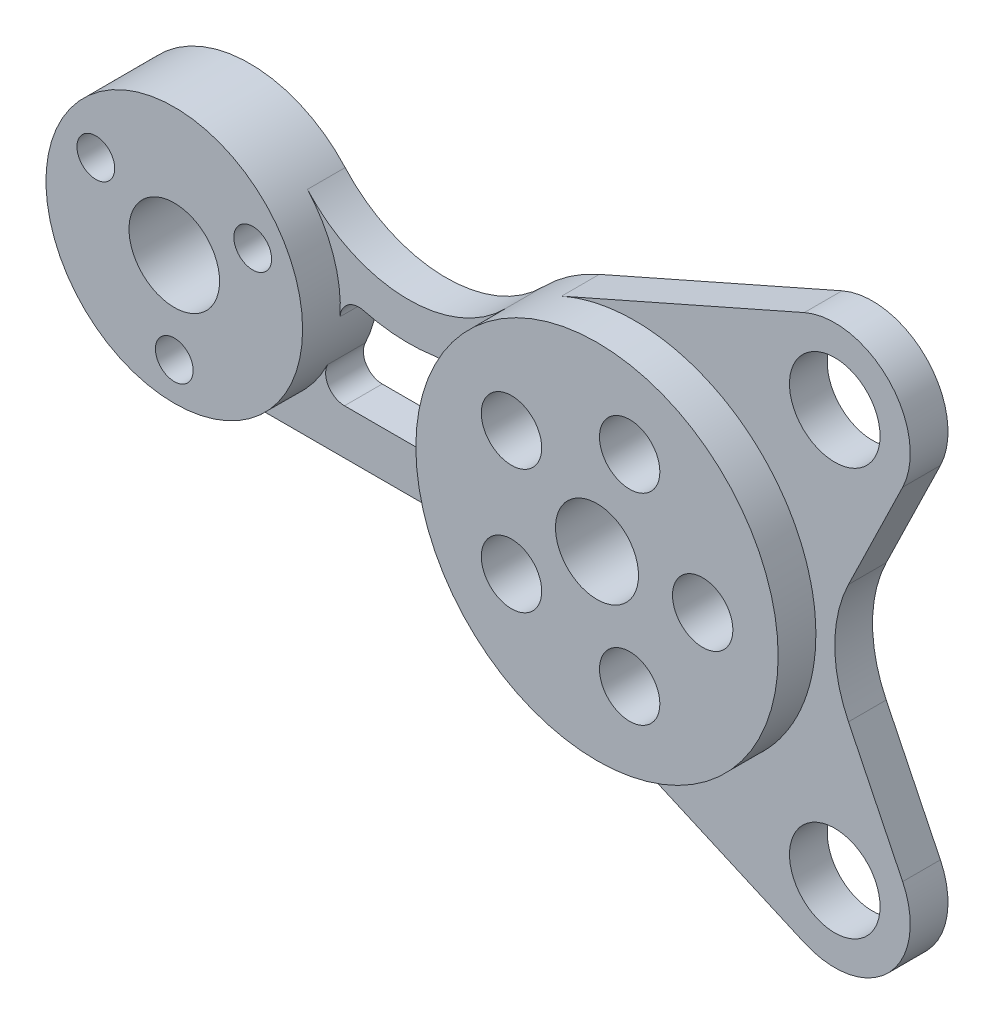
from build123d import *

# Parameters (mm, degrees)
EXTRUDE_1_DEPTH   = 10
EXTRUDE_1_2_DEPTH = 10
SKETCH_1_R        = 12
EXTRUDE_1_3_DEPTH = 10
SKETCH_1_3_R      = 34
SKETCH_1_3_R_2    = 5
SKETCH_1_3_R_3    = 12
SKETCH_1_3_R_4    = 48
SKETCH_1_3_R_5    = 11
SKETCH_1_3_R_6    = 8
EXTRUDE_2_DEPTH   = 20


with BuildPart() as part:
    # Эскиз1 → Бобышка-Вытянуть1 (new body)
    with BuildSketch(Plane.XY):
        with BuildLine():
            ThreePointArc((-34.265935077, 33.613177376), (-60.740277071, 22.831401034), (-86.726044816, 34.742629341))
            ThreePointArc((-86.726044816, 34.742629341), (-80.256382718, 24.179604339), (-78, 12))
            ThreePointArc((-78, 12), (-78.01696468, 10.926077072), (-78.067841791, 9.853225836))
            ThreePointArc((-78.067841791, 9.853225836), (-75.998410662, 13.595865972), (-71.792285963, 14.369439111))
            ThreePointArc((-71.792285963, 14.369439111), (-62.488542937, 12.892311655), (-53.0789829, 13.341443824))
            ThreePointArc((-53.0789829, 13.341443824), (-48.779316535, 11.917644182), (-47.393624859, 7.605545522))
            ThreePointArc((-47.393624859, 7.605545522), (-42.850556133, 21.62937445), (-34.265935077, 33.613177376))
        make_face()
    extrude(amount=EXTRUDE_1_DEPTH)



with BuildPart() as body_2:
    # Эскиз1 → Extrude 1 2 (new body)
    with BuildSketch(Plane.XY):
        with BuildLine():
            ThreePointArc((-81.400124188, -2.820512821), (-93.943109846, -16.808830555), (-112, -22))
            Line((-112, -22), (-50.990195136, -22))
            ThreePointArc((-50.990195136, -22), (-44.176343697, -23.636937904), (-38.849672485, -28.19047619))
            ThreePointArc((-38.849672485, -28.19047619), (-44.904412309, -16.958589421), (-47.785923471, -4.528301887))
            ThreePointArc((-47.785923471, -4.528301887), (-49.065077459, -8.364632925), (-52.763623833, -10))
            Line((-52.763623833, -10), (-76.90014245, -10))
            ThreePointArc((-76.90014245, -10), (-81.136735179, -7.655425023), (-81.400124188, -2.820512821))
        make_face()
    extrude(amount=EXTRUDE_1_2_DEPTH)


with BuildPart() as body_3:
    # Эскиз1 → Extrude 1 3 (new body)
    with BuildSketch(Plane.XY):
        with BuildLine():
            ThreePointArc((48, 0), (26.207195563, -40.21421267), (-19.382620863, -43.912572328))
            Line((-19.382620863, -43.912572328), (44.923907974, -72.296905137))
            ThreePointArc((44.923907974, -72.296905137), (67.402998534, -67.876369598), (70.983531351, -45.24828016))
            Line((70.983531351, -45.24828016), (56.629643569, -15.753095713))
            ThreePointArc((56.629643569, -15.753095713), (53, 0), (56.629643569, 15.753095713))
            Line((56.629643569, 15.753095713), (70.983531351, 45.24828016))
            ThreePointArc((70.983531351, 45.24828016), (67.402998534, 67.876369598), (44.923907974, 72.296905137))
            Line((44.923907974, 72.296905137), (-19.382620863, 43.912572328))
            ThreePointArc((-19.382620863, 43.912572328), (26.207195563, 40.21421267), (48, 0))
        make_face()
        with Locations((53, -54)):
            Circle(SKETCH_1_R, mode=Mode.SUBTRACT)
        with Locations((53, 54)):
            Circle(SKETCH_1_R, mode=Mode.SUBTRACT)
    extrude(amount=EXTRUDE_1_3_DEPTH)


with BuildPart() as part_1:
    add(part.part)

    add(body_2.part)  # Бобышка-Вытянуть2 merges body 2
    # Эскиз1<3> → Бобышка-Вытянуть2 (add)
    # profile 1 of 2: a face of its own
    with BuildSketch(Plane.XY):
        with Locations(Location((-112, 12, 0), (0, 0, 270))):
            Circle(SKETCH_1_3_R)
        with Locations((-112, -12)):
            Circle(SKETCH_1_3_R_2, mode=Mode.SUBTRACT)
        with Locations((-91.215390309, 24)):
            Circle(SKETCH_1_3_R_2, mode=Mode.SUBTRACT)
        with Locations((-132.784609691, 24)):
            Circle(SKETCH_1_3_R_2, mode=Mode.SUBTRACT)
        with Locations((-112, 12)):
            Circle(SKETCH_1_3_R_3, mode=Mode.SUBTRACT)
    # profile 2 of 2: a face of its own
    with BuildSketch(Plane.XY):
        with Locations(Location((0, 0, 0), (0, 0, 185.413312274))):
            Circle(SKETCH_1_3_R_4)
        Circle(SKETCH_1_3_R_5, mode=Mode.SUBTRACT)
        with Locations((-22.652475842, -16.457987064)):
            Circle(SKETCH_1_3_R_6, mode=Mode.SUBTRACT)
        with Locations((8.652475842, -26.629582456)):
            Circle(SKETCH_1_3_R_6, mode=Mode.SUBTRACT)
        with Locations((28, 0)):
            Circle(SKETCH_1_3_R_6, mode=Mode.SUBTRACT)
        with Locations((8.652475842, 26.629582456)):
            Circle(SKETCH_1_3_R_6, mode=Mode.SUBTRACT)
        with Locations((-22.652475842, 16.457987064)):
            Circle(SKETCH_1_3_R_6, mode=Mode.SUBTRACT)
    extrude(amount=EXTRUDE_2_DEPTH)


solid = Compound([body_3.part, part_1.part])
